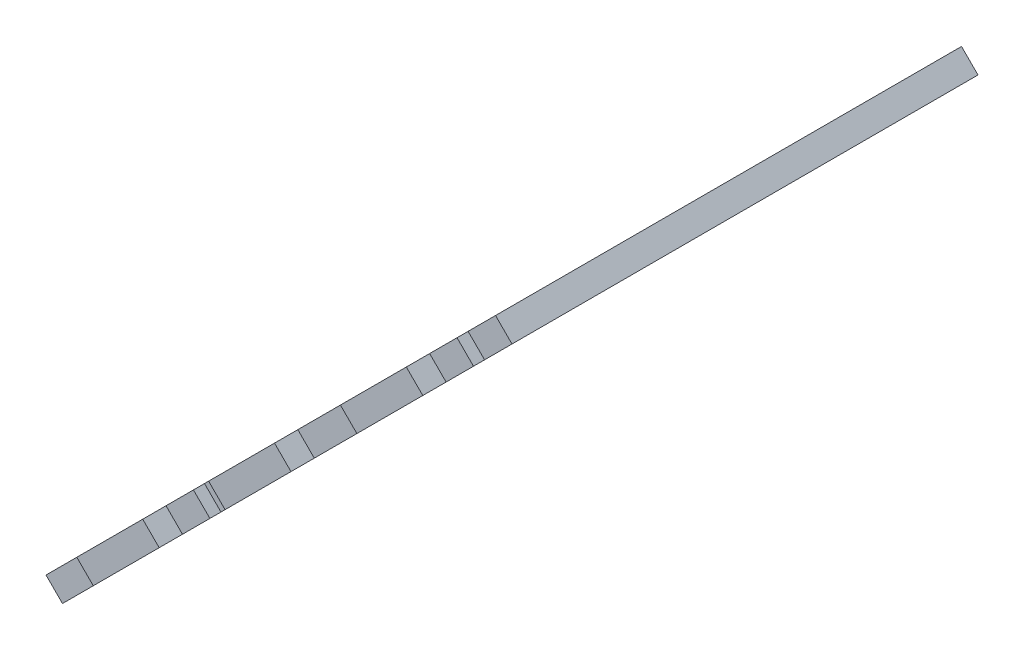
from build123d import *

# Parameters (mm, degrees)
BOSS_EXTRUDE1_DEPTH = 127
SKETCH2_W           = 25.4
SKETCH2_H           = 6.35
BOSS_EXTRUDE2_DEPTH = 6.35
LPATTERN1_COUNT     = 2
LPATTERN1_PITCH     = 50.8
SKETCH3_R           = 2.0955
CUT_EXTRUDE1_DEPTH  = 6.35
CUT_EXTRUDE2_DEPTH  = 6.35
BOSS_EXTRUDE4_DEPTH = 6.35
LPATTERN3_COUNT     = 3
LPATTERN3_PITCH     = 50.8
BOSS_EXTRUDE5_DEPTH = 6.35
LPATTERN4_COUNT     = 3
LPATTERN4_PITCH     = 50.8
CUT_EXTRUDE3_DEPTH  = 6.35


with BuildPart() as part:
    # Sketch1 → Boss-Extrude1 (new body)
    with BuildSketch(Plane.XY):
        Polygon((0, 127), (4.490128061, 122.509871939), (-118.019743879, 0), (-122.509871939, 4.490128061), align=None)
    extrude(amount=BOSS_EXTRUDE1_DEPTH)

    # Sketch2 → Boss-Extrude2 (add)
    with BuildSketch(Plane(origin=(-59.009871939, -59.009871939, 0), x_dir=(0, 0, 1), z_dir=(-0.7071067811865474, -0.7071067811865477, 0))):
        with Locations((38.1, 86.627561211)):
            Rectangle(SKETCH2_W, SKETCH2_H)
    boss_extrude2 = extrude(amount=BOSS_EXTRUDE2_DEPTH)

    # LPattern1: Boss-Extrude2 ×2
    with Locations(*[(0, 0, i * LPATTERN1_PITCH) for i in range(1, LPATTERN1_COUNT)]):
        add(boss_extrude2)

    # Sketch3 → Cut-Extrude1 (cut)
    with BuildSketch(Plane(origin=(-59.009871939, 59.009871939, 0), x_dir=(0, 0, -1), z_dir=(0.7071067811865476, -0.7071067811865476, 0))):
        with Locations(Location((-38.1, -86.627561211, 0), (0, 0, 90))):
            Circle(SKETCH3_R)
        with Locations(Location((-88.979711059, -86.627561211, 0), (0, 0, 90))):
            Circle(SKETCH3_R)
    extrude(amount=-CUT_EXTRUDE1_DEPTH, mode=Mode.SUBTRACT)

    # Sketch4 → Cut-Extrude2 (cut)
    with BuildSketch(Plane(origin=(-63.5, 63.5, 0), x_dir=(0, 0, 1), z_dir=(-0.7071067811865476, 0.7071067811865476, 0))):
        Polygon((10.5664, -83.452561211), (14.8336, -83.452561211), (14.8336, -74.689561211), (17.145, -74.689561211), (17.145, -71.514561211), (14.8336, -71.514561211), (14.8336, -68.212561211), (10.5664, -68.212561211), (10.5664, -71.514561211), (8.255, -71.514561211), (8.255, -74.689561211), (10.5664, -74.689561211), align=None)
        Polygon((112.1664, -83.452561211), (116.4336, -83.452561211), (116.4336, -74.689561211), (118.745, -74.689561211), (118.745, -71.514561211), (116.4336, -71.514561211), (116.4336, -68.212561211), (112.1664, -68.212561211), (112.1664, -71.514561211), (109.855, -71.514561211), (109.855, -74.689561211), (112.1664, -74.689561211), align=None)
    extrude(amount=-CUT_EXTRUDE2_DEPTH, mode=Mode.SUBTRACT)

    # Sketch6 → Boss-Extrude4 (add)
    with BuildSketch(Plane(origin=(0, 0, 0), x_dir=(-1, 0, 0), z_dir=(0, 0, -1))):
        Polygon((13.470384182, 104.549359697), (17.960512242, 109.039487758), (35.921024484, 91.078975516), (31.430896424, 86.588847455), align=None)
    boss_extrude4 = extrude(amount=BOSS_EXTRUDE4_DEPTH)

    # LPattern3: Boss-Extrude4 ×3
    with Locations(*[Vector(-0.7071067811865481, -0.7071067811865469, 0) * (i * LPATTERN3_PITCH) for i in range(1, LPATTERN3_COUNT)]):
        add(boss_extrude4)

    # Sketch7 → Boss-Extrude5 (add)
    with BuildSketch(Plane.XY.offset(127)):
        Polygon((-17.960512242, 109.039487758), (-13.470384182, 104.549359697), (-31.430896424, 86.588847455), (-35.921024484, 91.078975516), align=None)
    boss_extrude5 = extrude(amount=BOSS_EXTRUDE5_DEPTH)

    # LPattern4: Boss-Extrude5 ×3
    with Locations(*[Vector(-0.7071067811865475, -0.7071067811865476, 0) * (i * LPATTERN4_PITCH) for i in range(1, LPATTERN4_COUNT)]):
        add(boss_extrude5)

    # Sketch8 → Cut-Extrude3 (cut)
    with BuildSketch(Plane(origin=(-63.5, 63.5, 0), x_dir=(0, 0, 1), z_dir=(-0.7071067811865476, 0.7071067811865476, 0))):
        Polygon((127, -26.631038789), (127, -22.363838789), (118.237, -22.363838789), (118.237, -20.052438789), (115.062, -20.052438789), (115.062, -22.363838789), (111.76, -22.363838789), (111.76, -26.631038789), (115.062, -26.631038789), (115.062, -28.942438789), (118.237, -28.942438789), (118.237, -26.631038789), align=None)
        Polygon((0, 79.236161211), (0, 74.968961211), (8.763, 74.968961211), (8.763, 72.657561211), (11.938, 72.657561211), (11.938, 74.968961211), (15.24, 74.968961211), (15.24, 79.236161211), (11.938, 79.236161211), (11.938, 81.547561211), (8.763, 81.547561211), (8.763, 79.236161211), align=None)
        Polygon((0, -22.363838789), (0, -26.631038789), (8.763, -26.631038789), (8.763, -28.942438789), (11.938, -28.942438789), (11.938, -26.631038789), (15.24, -26.631038789), (15.24, -22.363838789), (11.938, -22.363838789), (11.938, -20.052438789), (8.763, -20.052438789), (8.763, -22.363838789), align=None)
        Polygon((127, 74.968961211), (127, 79.236161211), (118.237, 79.236161211), (118.237, 81.547561211), (115.062, 81.547561211), (115.062, 79.236161211), (111.76, 79.236161211), (111.76, 74.968961211), (115.062, 74.968961211), (115.062, 72.657561211), (118.237, 72.657561211), (118.237, 74.968961211), align=None)
    extrude(amount=-CUT_EXTRUDE3_DEPTH, mode=Mode.SUBTRACT)


solid = part.part
